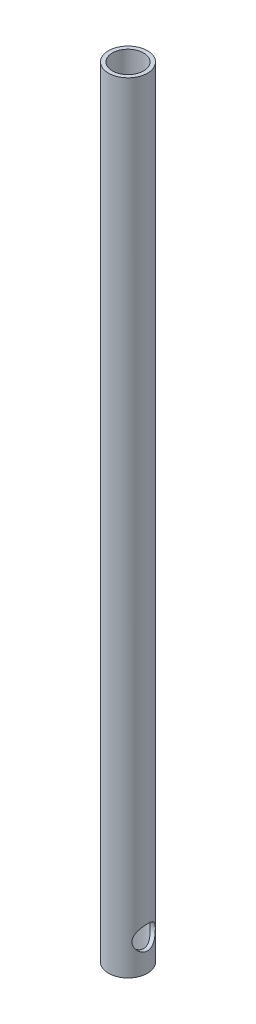
from build123d import *

# Parameters (mm, degrees)
SKETCH1_R               = 2.5
SKETCH1_R_2             = 2
BOSS_EXTRUDE1_DEPTH     = 100
CUT_EXTRUDE1_DEPTH      = 10
CUT_EXTRUDE1_DEPTH_BACK = 10
SKETCH2_R               = 1.5


with BuildPart() as part:
    # Sketch1 → Boss-Extrude1 (new body)
    with BuildSketch(Plane(origin=(0, 0, 0), x_dir=(1, 0, 0), z_dir=(0, 1, 0))):
        Circle(SKETCH1_R)
        Circle(SKETCH1_R_2, mode=Mode.SUBTRACT)
    extrude(amount=BOSS_EXTRUDE1_DEPTH)

    # Sketch2 → Cut-Extrude1 (cut, two sides: drawn at the far end of the back side and taken through both)
    with BuildSketch(Plane(origin=(0, 0, 0), x_dir=(0, 0, -1), z_dir=(1, 0, 0)).offset(-CUT_EXTRUDE1_DEPTH_BACK)):
        with Locations((0, 4)):
            Circle(SKETCH2_R)
    extrude(amount=CUT_EXTRUDE1_DEPTH + CUT_EXTRUDE1_DEPTH_BACK, mode=Mode.SUBTRACT)


solid = part.part
